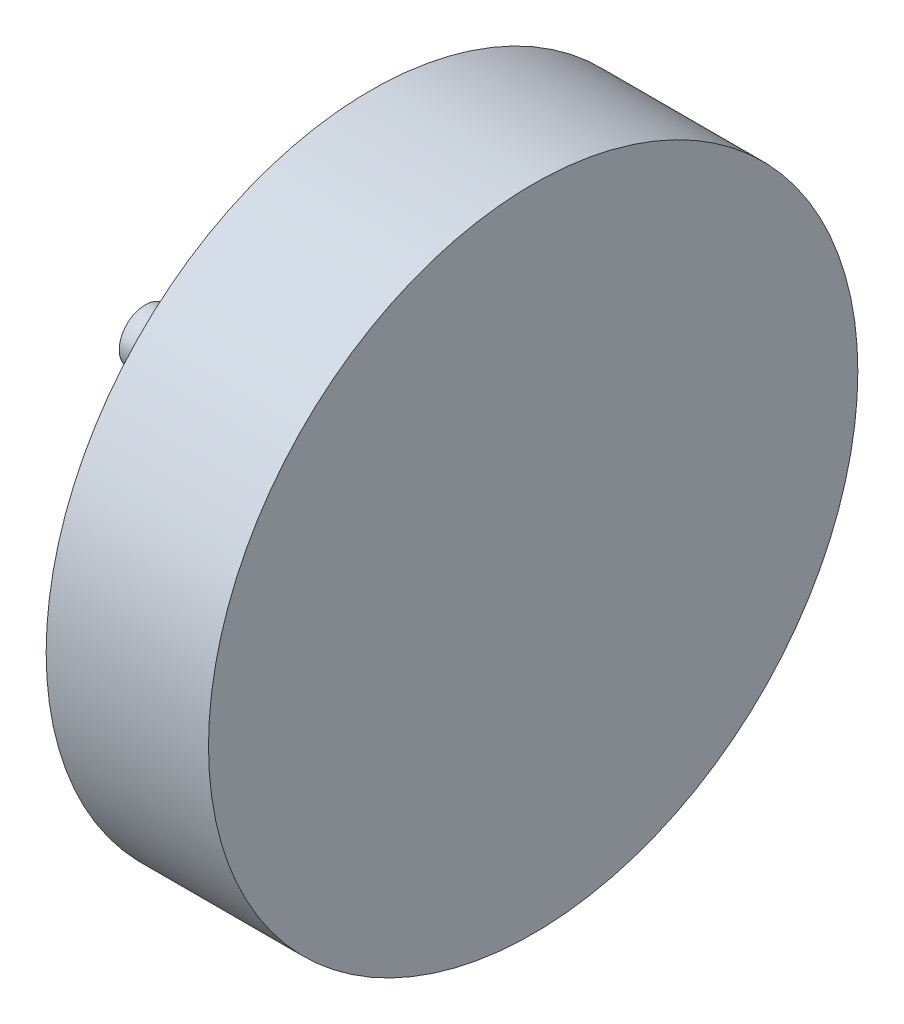
from build123d import *

# Parameters (mm, degrees)
SKETCH2_R           = 50
BOSS_EXTRUDE1_DEPTH = 25
SKETCH3_R           = 4
BOSS_EXTRUDE2_DEPTH = 59.75


with BuildPart() as part:
    # Sketch2 → Boss-Extrude1 (new body)
    with BuildSketch(Plane(origin=(70.75, 0, -252.75), x_dir=(0, 0, -1), z_dir=(1, 0, 0))):
        Circle(SKETCH2_R)
    extrude(amount=-BOSS_EXTRUDE1_DEPTH)

    # Sketch3 → Boss-Extrude2 (add)
    with BuildSketch(Plane(origin=(70.75, 0, -252.75), x_dir=(0, 0, -1), z_dir=(1, 0, 0))):
        Circle(SKETCH3_R)
    extrude(amount=-BOSS_EXTRUDE2_DEPTH)


solid = part.part
